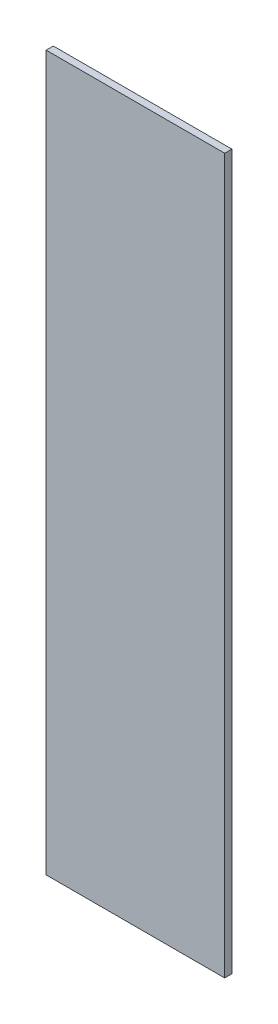
from build123d import *

# Parameters (mm, degrees)
SKETCH1_W           = 50
SKETCH1_H           = 2
BOSS_EXTRUDE1_DEPTH = 200


with BuildPart() as part:
    # Sketch1 → Boss-Extrude1 (new body)
    with BuildSketch(Plane(origin=(0, 0, 0), x_dir=(1, 0, 0), z_dir=(0, 1, 0))):
        Rectangle(SKETCH1_W, SKETCH1_H)
    extrude(amount=BOSS_EXTRUDE1_DEPTH)


solid = part.part
